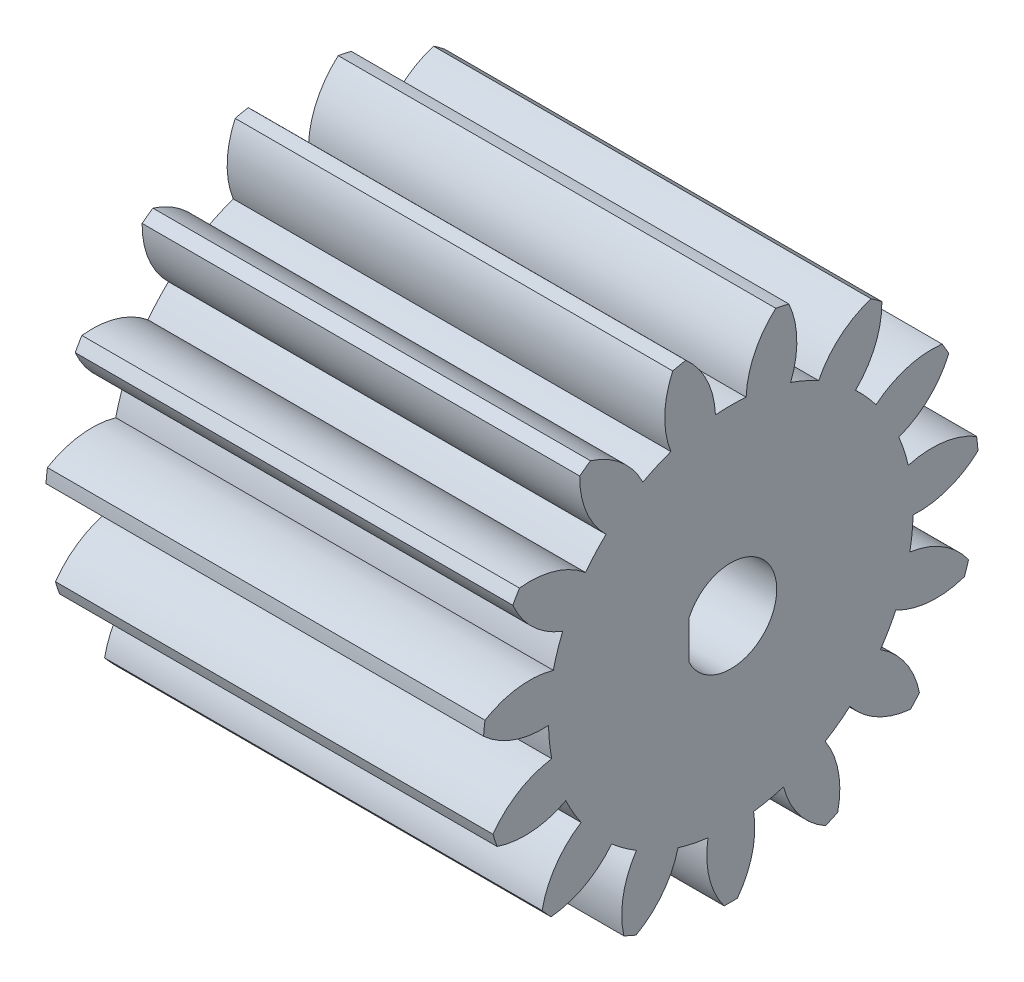
from build123d import *

# Parameters (mm, degrees)
BASPROSKE_W              = 30
BASPROSKE_H              = 17
TOOTHCUT_DEPTH           = 39.444765573
TEETHCUTS_COUNT          = 15
TEETHCUTS_ANGLE          = 336
BORSKE_R                 = 5
BORE_DEPTH               = 50.0000508
ESBO_O1_R                = 5
RESSALTO_EXTRUS_O1_DEPTH = 30
CORTE_EXTRUS_O1_REACH    = 40.422


with BuildPart() as part:
    # BasProSke → Base-Revolve (revolve)
    with BuildSketch(Plane(origin=(0, 0, 0), x_dir=(1, 0, 0), z_dir=(0, 1, 0)), mode=Mode.PRIVATE) as base_revolve_sk:
        with Locations((15, 8.5)):
            Rectangle(BASPROSKE_W, BASPROSKE_H)
    revolve(base_revolve_sk.sketch.rotate(Axis((-10, 0, 0), (1, 0, 0)), 180), axis=Axis((-10, 0, 0), (1, 0, 0)))

    # TooCutSke → ToothCut (cut, through all)
    with BuildSketch(Plane(origin=(0, 0, 0), x_dir=(0, 0, -1), z_dir=(1, 0, 0))):
        with BuildLine():
            ThreePointArc((1.050056448, 12.454813626), (0, 12.499), (-1.050056448, 12.454813626))
            ThreePointArc((-1.050056448, 12.454813626), (-1.638118106, 14.809604533), (-3.110934279, 16.73876737))
            ThreePointArc((-3.110934279, 16.73876737), (0, 17.0254), (3.110934279, 16.73876737))
            ThreePointArc((3.110934279, 16.73876737), (1.638118106, 14.809604533), (1.050056448, 12.454813626))
        make_face()
    toothcut = extrude(amount=TOOTHCUT_DEPTH, mode=Mode.SUBTRACT)

    # TeethCuts: ToothCut ×15 about axis
    teethcuts_axis = Axis((-10, 0, 0), (1, 0, 0))
    for i in range(1, TEETHCUTS_COUNT):
        add(toothcut.rotate(teethcuts_axis, i * TEETHCUTS_ANGLE / (TEETHCUTS_COUNT - 1)), mode=Mode.SUBTRACT)

    # BorSke → Bore (cut, symmetric)
    with BuildSketch(Plane(origin=(0, 0, 0), x_dir=(0, 0, -1), z_dir=(1, 0, 0))):
        with Locations(Location((0, 0, 0), (0, 0, 180))):
            Circle(BORSKE_R)
    extrude(amount=BORE_DEPTH, both=True, mode=Mode.SUBTRACT)

    # Esboço1 → Ressalto-extrusão1 (add)
    with BuildSketch(Plane(origin=(30, 0, 0), x_dir=(0, 0, -1), z_dir=(1, 0, 0))):
        Circle(ESBO_O1_R)
    extrude(amount=-RESSALTO_EXTRUS_O1_DEPTH)

    # Esboço2 → Corte-extrusão1 (cut, up to next)
    with BuildSketch(Plane(origin=(30, 0, 0), x_dir=(0, 0, -1), z_dir=(1, 0, 0)), mode=Mode.PRIVATE) as corte_extrus_o1_sk1:
        with BuildLine():
            Line((-2.85, 1.341640786), (-2.85, -1.341640786))
            ThreePointArc((-2.85, -1.341640786), (3.15, 0), (-2.85, 1.341640786))
        make_face()
    corte_extrus_o1_tool1 = extrude(corte_extrus_o1_sk1.sketch, amount=-CORTE_EXTRUS_O1_REACH, mode=Mode.PRIVATE) & part.part
    add(corte_extrus_o1_tool1.solids().sort_by_distance((30, 0, -0.052561))[0], mode=Mode.SUBTRACT)


solid = part.part
